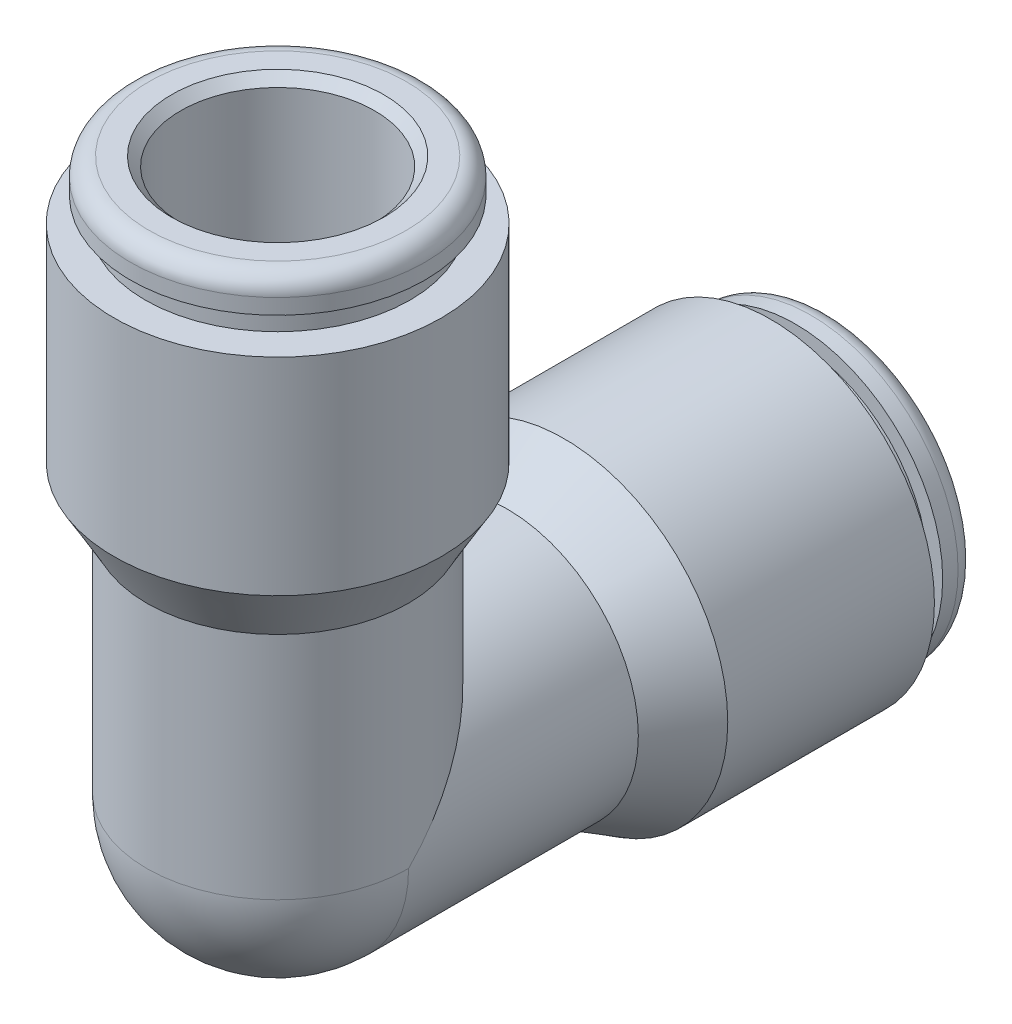
from build123d import *

# Parameters (mm, degrees)
CIRPATTERN1_COUNT = 2
CIRPATTERN1_ANGLE = 90
REVOLVE2_ANGLE    = 90
CIRPATTERN2_COUNT = 2
CIRPATTERN2_ANGLE = 90


with BuildPart() as part:
    # Sketch1 → Revolve1 (revolve)
    with BuildSketch(Plane(origin=(0, 0, 0), x_dir=(0, 0, -1), z_dir=(1, 0, 0)), mode=Mode.PRIVATE) as revolve1_sk:
        with BuildLine():
            Line((21.353, 6.075), (21.988, 6.075))
            ThreePointArc((21.988, 6.075), (22.526815367, 5.851815367), (22.75, 5.313))
            Line((22.75, 5.313), (22.75, 4.381))
            Line((22.75, 4.381), (22.369, 4))
            Line((22.369, 4), (8, 4))
            Line((8, 4), (8, 3.238))
            Line((8, 3.238), (0, 3.238))
            Line((0, 3.238), (0, 5.4))
            Line((0, 5.4), (9.475, 5.4))
            Line((9.475, 5.4), (11.81326859, 6.75))
            Line((11.81326859, 6.75), (20.337, 6.75))
            Line((20.337, 6.75), (20.337, 5.4675))
            Line((20.337, 5.4675), (21.353, 5.4675))
            Line((21.353, 5.4675), (21.353, 6.075))
        make_face()
    revolve(revolve1_sk.sketch.rotate(Axis((0, 0, 0), (0, 0, -1)), 90), axis=Axis((0, 0, 0), (0, 0, -1)))


with BuildPart() as cirpattern1_1:
    # CirPattern1: pattern copy
    add(part.part.rotate(Axis((-7.425, 0, 0), (1, 0, 0)), 1 * CIRPATTERN1_ANGLE / (CIRPATTERN1_COUNT - 1)))


with BuildPart() as part_1:
    add(part.part)

    # Sketch2 → Revolve2 (revolve)
    with BuildSketch(Plane.XY):
        with BuildLine():
            Line((-5.4, 0), (-3.238, 0))
            ThreePointArc((-3.238, 0), (0, -3.238), (3.238, 0))
            Line((3.238, 0), (5.4, 0))
            ThreePointArc((5.4, 0), (0, -5.4), (-5.4, 0))
        make_face()
    revolve(axis=Axis((-5.4, 0, 0), (-1, 0, 0)), revolution_arc=REVOLVE2_ANGLE)

    # Combine1: union CirPattern1_1
    add(cirpattern1_1.part)

    # Sketch3 → Cut-Revolve1 (revolve, cut)
    with BuildSketch(Plane(origin=(0, 0, 0), x_dir=(0, 0, -1), z_dir=(1, 0, 0)), mode=Mode.PRIVATE) as cut_revolve1_sk:
        Polygon((22.75, 4.381), (22.369, 4), (8, 4), (8, 3.238), (0, 3.238), (0, 0), (22.75, 0), align=None)
    cut_revolve1 = revolve(cut_revolve1_sk.sketch.rotate(Axis((0, 0, 0), (0, 0, -1)), 90), axis=Axis((0, 0, 0), (0, 0, -1)), mode=Mode.SUBTRACT)

    # CirPattern2: Cut-Revolve1 ×2 about axis
    cirpattern2_axis = Axis((-7.425, 0, 0), (1, 0, 0))
    for i in range(1, CIRPATTERN2_COUNT):
        add(cut_revolve1.rotate(cirpattern2_axis, i * CIRPATTERN2_ANGLE / (CIRPATTERN2_COUNT - 1)), mode=Mode.SUBTRACT)


solid = part_1.part
